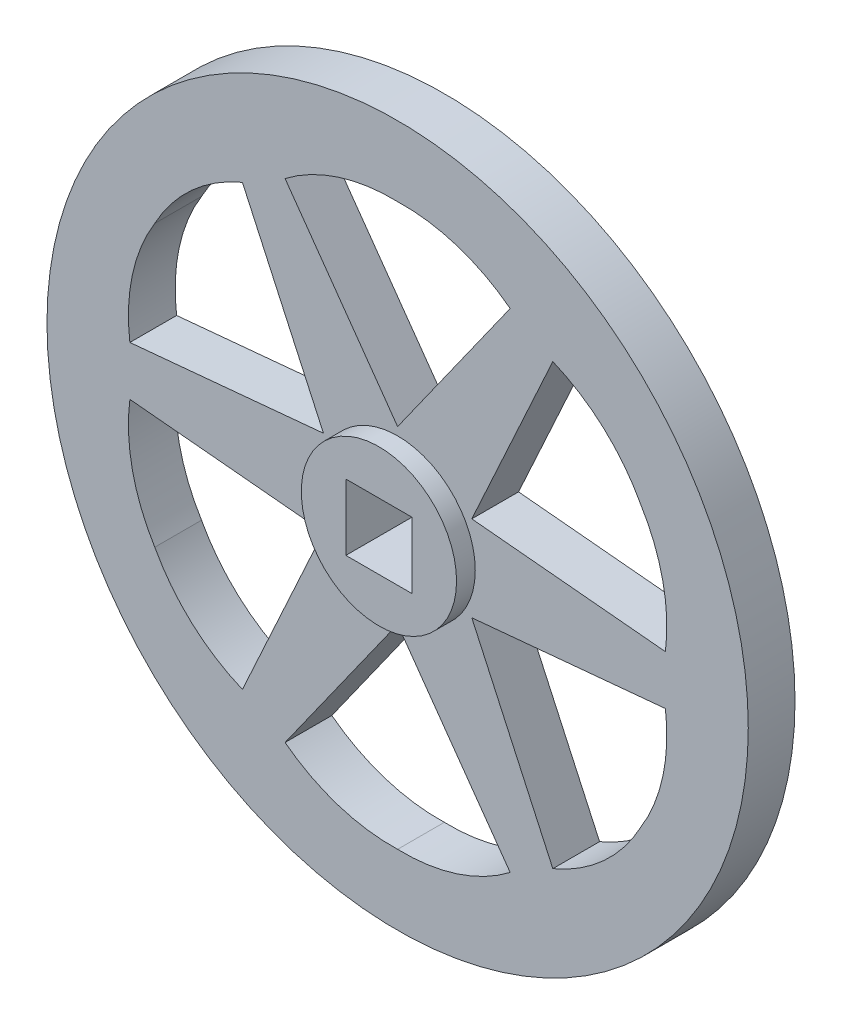
from build123d import *

# Parameters (mm, degrees)
SKETCH1_R           = 37.5
SKETCH1_W           = 7.071067812
SKETCH1_H           = 7.071067812
BOSS_EXTRUDE1_DEPTH = 2.5
CUT_EXTRUDE1_DEPTH  = 4
CIRPATTERN1_COUNT   = 6
SKETCH4_R           = 8.302662018
SKETCH4_W           = 7.071067812
SKETCH4_H           = 7.071067812
BOSS_EXTRUDE2_DEPTH = 2


with BuildPart() as part:
    # Sketch1 → Boss-Extrude1 (new, symmetric)
    with BuildSketch(Plane.XY):
        Circle(SKETCH1_R)
        Rectangle(SKETCH1_W, SKETCH1_H, mode=Mode.SUBTRACT)
    extrude(amount=BOSS_EXTRUDE1_DEPTH, both=True)

    # Sketch2 → Cut-Extrude1 (cut, symmetric)
    with BuildSketch(Plane.XY):
        with BuildLine():
            Line((0, 9.158641407), (-12.037071564, 26.115211784))
            ThreePointArc((-12.037071564, 26.115211784), (-6.351662121, 29.087034336), (0, 29.988143709))
            ThreePointArc((0, 29.988143709), (6.351662121, 29.087034336), (12.037071564, 26.115211784))
            Line((12.037071564, 26.115211784), (0, 9.158641407))
        make_face()
    cut_extrude1 = extrude(amount=CUT_EXTRUDE1_DEPTH, both=True, mode=Mode.SUBTRACT)

    # CirPattern1: Cut-Extrude1 ×6 about axis
    cirpattern1_axis = Axis((0, 0, 0), (0, 0, 1))
    for i in range(1, CIRPATTERN1_COUNT):
        add(cut_extrude1.rotate(cirpattern1_axis, i * 360 / CIRPATTERN1_COUNT), mode=Mode.SUBTRACT)

    # Sketch4 → Boss-Extrude2 (add)
    with BuildSketch(Plane.XY.offset(2.5)):
        Circle(SKETCH4_R)
        Rectangle(SKETCH4_W, SKETCH4_H, mode=Mode.SUBTRACT)
    extrude(amount=BOSS_EXTRUDE2_DEPTH)


solid = part.part
